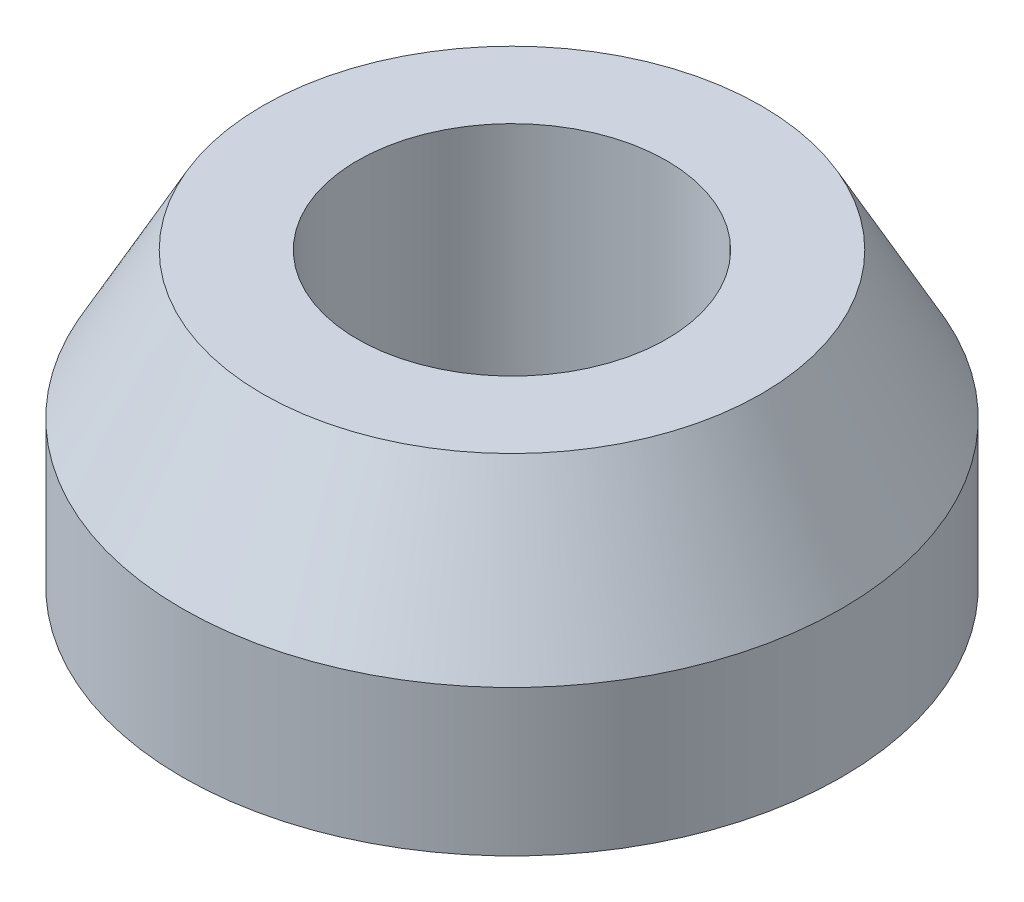
from build123d import *


with BuildPart() as part:
    # Sketch1 → Revolve1 (revolve)
    with BuildSketch(Plane.XY, mode=Mode.PRIVATE) as revolve1_sk:
        Polygon((6.731, 0), (14.351, 0), (14.351, 6.35), (10.8585, 12.7), (6.731, 12.7), align=None)
    revolve(revolve1_sk.sketch.rotate(Axis((0, 0, 0), (0, 1, 0)), 90), axis=Axis((0, 0, 0), (0, 1, 0)))


solid = part.part
